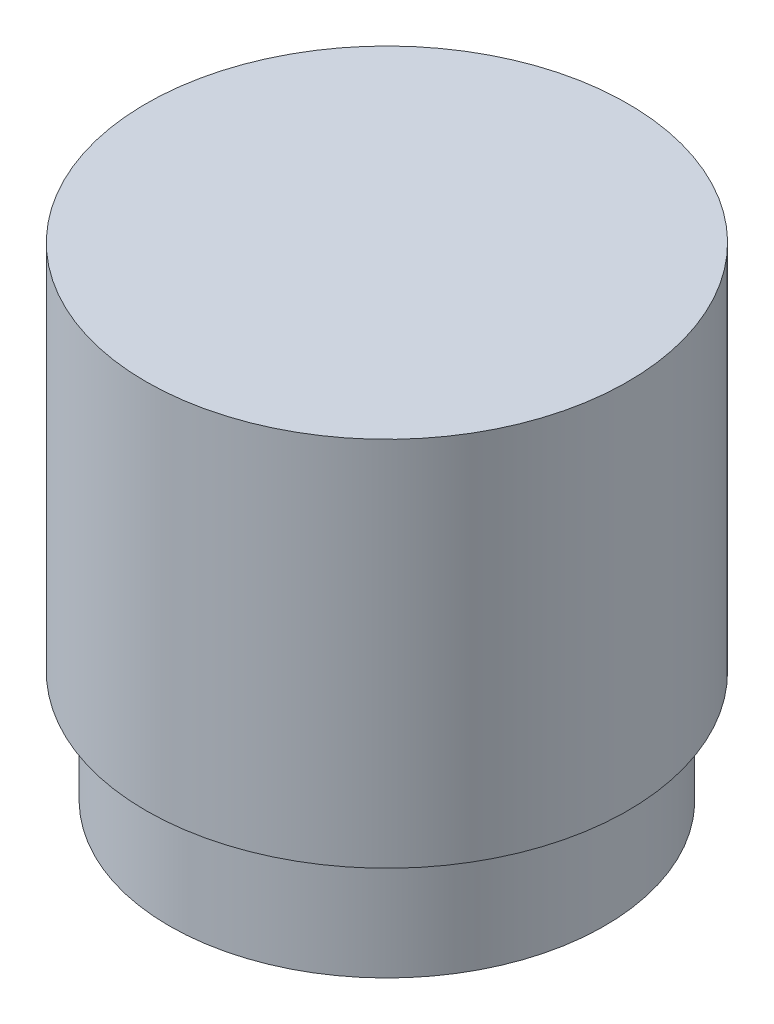
from build123d import *

# Parameters (mm, degrees)
SKETCH1_R           = 1.875
BOSS_EXTRUDE1_DEPTH = 0.96
SKETCH2_R           = 2.075
BOSS_EXTRUDE2_DEPTH = 3.2


with BuildPart() as part:
    # Sketch1 → Boss-Extrude1 (new body)
    with BuildSketch(Plane(origin=(0, 0, 0), x_dir=(1, 0, 0), z_dir=(0, 1, 0))):
        with Locations(Location((0, 0, 0), (0, 0, 270))):
            Circle(SKETCH1_R)
    extrude(amount=BOSS_EXTRUDE1_DEPTH)

    # Sketch2 → Boss-Extrude2 (add)
    with BuildSketch(Plane(origin=(0, 0.96, 0), x_dir=(1, 0, 0), z_dir=(0, 1, 0))):
        with Locations(Location((0, 0, 0), (0, 0, 270))):
            Circle(SKETCH2_R)
    extrude(amount=BOSS_EXTRUDE2_DEPTH)


solid = part.part
